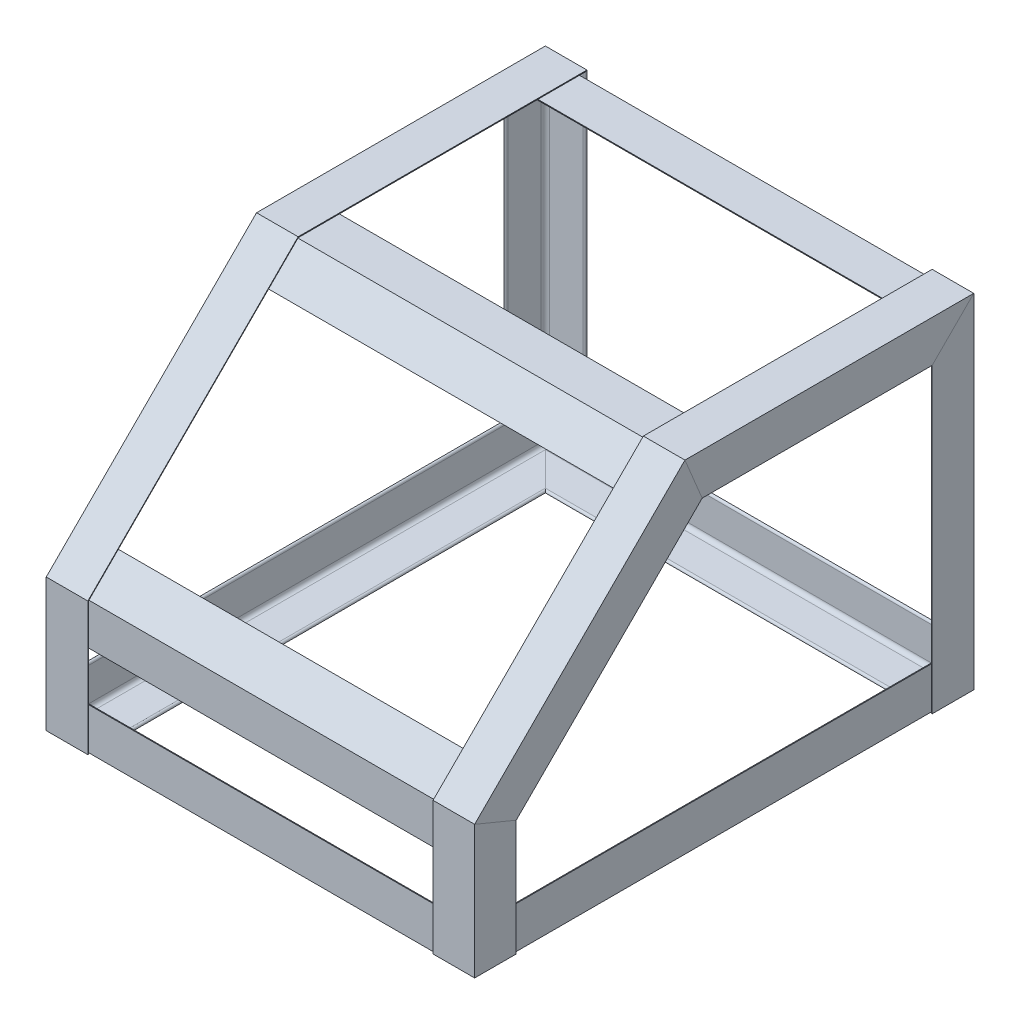
from build123d import *

# Parameters (mm, degrees)
NGULO_DE_EXTREMOS_REDONDEADOS_AL_I_AL_L_DEPTH      = 850.142792782
NGULO_DE_EXTREMOS_REDONDEADOS_AL_I_AL_L_DEPTH_BACK = 100.842792782
NGULO_DE_EXTREMOS_REDONDEADOS_AL_I_A_4_DEPTH       = 843.035585563
NGULO_DE_EXTREMOS_REDONDEADOS_AL_I_A_6_DEPTH       = 950.985585563
NGULO_DE_EXTREMOS_REDONDEADOS_AL_I_A_8_DEPTH       = 843.035585563
NGULO_DE_EXTREMOS_REDONDEADOS_AL_I_A_11_DEPTH      = 241.397438789
NGULO_DE_EXTREMOS_REDONDEADOS_AL_I_A_13_DEPTH      = 530.43662706
NGULO_DE_EXTREMOS_REDONDEADOS_AL_I_A_16_DEPTH      = 569.944
NGULO_DE_EXTREMOS_REDONDEADOS_AL_I_A_19_DEPTH      = 615.058561211
NGULO_DE_EXTREMOS_REDONDEADOS_AL_I_A_21_DEPTH      = 241.397438789
NGULO_DE_EXTREMOS_REDONDEADOS_AL_I_A_23_DEPTH      = 530.43662706
NGULO_DE_EXTREMOS_REDONDEADOS_AL_I_A_26_DEPTH      = 569.944
NGULO_DE_EXTREMOS_REDONDEADOS_AL_I_A_29_DEPTH      = 615.058561211
SALIENTE_EXTRUIR1_DEPTH                            = 647.7
SALIENTE_EXTRUIR1_2_DEPTH                          = 647.7
NGULO_DE_EXTREMOS_REDONDEADOS_AL_I_A_31_DEPTH      = 641.35


with BuildPart() as part:
    # Sketch1 → ngulo de extremos redondeados al i AL L (new, two sides: drawn at the far end of the back side and taken through both)
    with BuildSketch(Plane(origin=(-3.175, -9.525, -749.3), x_dir=(1, 0, 0), z_dir=(0, 0, 1)).offset(-NGULO_DE_EXTREMOS_REDONDEADOS_AL_I_AL_L_DEPTH_BACK)):
        with BuildLine():
            Line((0, 0), (0, 63.5))
            Line((0, 63.5), (0.00508, 63.5))
            ThreePointArc((0.00508, 63.5), (2.246551928, 62.571551928), (3.175, 60.33008))
            Line((3.175, 60.33008), (3.175, 9.525))
            ThreePointArc((3.175, 9.525), (5.034871939, 5.034871939), (9.525, 3.175))
            Line((9.525, 3.175), (60.33008, 3.175))
            ThreePointArc((60.33008, 3.175), (62.571551928, 2.246551928), (63.5, 0.00508))
            Line((63.5, 0.00508), (63.5, 0))
            Line((63.5, 0), (0, 0))
        make_face()
    extrude(amount=NGULO_DE_EXTREMOS_REDONDEADOS_AL_I_AL_L_DEPTH + NGULO_DE_EXTREMOS_REDONDEADOS_AL_I_AL_L_DEPTH_BACK)

    # ngulo de extremos redondeados al i A 2
    split(bisect_by=Plane(origin=(0, 0, -749.3), x_dir=(0, -1, 0), z_dir=(-0.707106781, 0, 0.707106781)), keep=Keep.TOP)

    # ngulo de extremos redondeados al i A 3
    split(bisect_by=Plane(origin=(0, 0, 0), x_dir=(0, -1, 0), z_dir=(-0.707106781, 0, -0.707106781)), keep=Keep.TOP)


with BuildPart() as body_2:
    # Sketch1 on segment 2 (carried to segment 2) → ngulo de extremos redondeados al i A 4 (new body)
    with BuildSketch(Plane(origin=(-100.842792782, -9.525, 3.175), x_dir=(0, 0, -1), z_dir=(1, 0, 0))):
        with BuildLine():
            Line((0, 0), (0, 63.5))
            Line((0, 63.5), (0.00508, 63.5))
            ThreePointArc((0.00508, 63.5), (2.246551928, 62.571551928), (3.175, 60.33008))
            Line((3.175, 60.33008), (3.175, 9.525))
            ThreePointArc((3.175, 9.525), (5.034871939, 5.034871939), (9.525, 3.175))
            Line((9.525, 3.175), (60.33008, 3.175))
            ThreePointArc((60.33008, 3.175), (62.571551928, 2.246551928), (63.5, 0.00508))
            Line((63.5, 0.00508), (63.5, 0))
            Line((63.5, 0), (0, 0))
        make_face()
    extrude(amount=NGULO_DE_EXTREMOS_REDONDEADOS_AL_I_A_4_DEPTH)

    # ngulo de extremos redondeados al i A 4 m
    split(bisect_by=Plane(origin=(641.35, 0, 0), x_dir=(0, -1, 0), z_dir=(-0.707106781, 0, 0.707106781)), keep=Keep.TOP)

    # ngulo de extremos redondeados al i A 5
    split(bisect_by=Plane(origin=(0, 0, 0), x_dir=(0, 1, 0), z_dir=(0.707106781, 0, 0.707106781)), keep=Keep.TOP)


with BuildPart() as body_3:
    # Sketch1 on segment 3 (carried to segment 3) → ngulo de extremos redondeados al i A 6 (new body)
    with BuildSketch(Plane(origin=(644.525, -9.525, 100.842792782), x_dir=(-1, 0, 0), z_dir=(0, 0, -1))):
        with BuildLine():
            Line((0, 0), (0, 63.5))
            Line((0, 63.5), (0.00508, 63.5))
            ThreePointArc((0.00508, 63.5), (2.246551928, 62.571551928), (3.175, 60.33008))
            Line((3.175, 60.33008), (3.175, 9.525))
            ThreePointArc((3.175, 9.525), (5.034871939, 5.034871939), (9.525, 3.175))
            Line((9.525, 3.175), (60.33008, 3.175))
            ThreePointArc((60.33008, 3.175), (62.571551928, 2.246551928), (63.5, 0.00508))
            Line((63.5, 0.00508), (63.5, 0))
            Line((63.5, 0), (0, 0))
        make_face()
    extrude(amount=NGULO_DE_EXTREMOS_REDONDEADOS_AL_I_A_6_DEPTH)

    # ngulo de extremos redondeados al i A 6 m
    split(bisect_by=Plane(origin=(641.35, 0, 0), x_dir=(0, 1, 0), z_dir=(0.707106781, 0, -0.707106781)), keep=Keep.TOP)

    # ngulo de extremos redondeados al i A 7
    split(bisect_by=Plane(origin=(641.35, 0, -749.3), x_dir=(0, 1, 0), z_dir=(0.707106781, 0, 0.707106781)), keep=Keep.TOP)


with BuildPart() as body_4:
    # Sketch1 on segment 4 (carried to segment 4) → ngulo de extremos redondeados al i A 8 (new body)
    with BuildSketch(Plane(origin=(742.192792782, -9.525, -752.475), x_dir=(0, 0, 1), z_dir=(-1, 0, 0))):
        with BuildLine():
            Line((0, 0), (0, 63.5))
            Line((0, 63.5), (0.00508, 63.5))
            ThreePointArc((0.00508, 63.5), (2.246551928, 62.571551928), (3.175, 60.33008))
            Line((3.175, 60.33008), (3.175, 9.525))
            ThreePointArc((3.175, 9.525), (5.034871939, 5.034871939), (9.525, 3.175))
            Line((9.525, 3.175), (60.33008, 3.175))
            ThreePointArc((60.33008, 3.175), (62.571551928, 2.246551928), (63.5, 0.00508))
            Line((63.5, 0.00508), (63.5, 0))
            Line((63.5, 0), (0, 0))
        make_face()
    extrude(amount=NGULO_DE_EXTREMOS_REDONDEADOS_AL_I_A_8_DEPTH)

    # ngulo de extremos redondeados al i A 8 m
    split(bisect_by=Plane(origin=(641.35, 0, -749.3), x_dir=(0, -1, 0), z_dir=(-0.707106781, 0, -0.707106781)), keep=Keep.TOP)

    # ngulo de extremos redondeados al i A 9
    split(bisect_by=Plane(origin=(0, 0, -749.3), x_dir=(0, 1, 0), z_dir=(0.707106781, 0, -0.707106781)), keep=Keep.TOP)


with BuildPart() as part_1:
    add(part.part)

    # ngulo de extremos redondeados al i A 10: union body 2, body 3, body 4
    add(body_2.part)
    add(body_3.part)
    add(body_4.part)


with BuildPart() as body_2_2:
    # Sketch12 → ngulo de extremos redondeados al i A 11 (new body)
    with BuildSketch(Plane(origin=(647.7, -9.525, 6.35), x_dir=(-1, 0, 0), z_dir=(0, -1, 0))):
        with BuildLine():
            Line((0, 0), (0, 63.5))
            Line((0, 63.5), (0.00508, 63.5))
            ThreePointArc((0.00508, 63.5), (2.246551928, 62.571551928), (3.175, 60.33008))
            Line((3.175, 60.33008), (3.175, 9.525))
            ThreePointArc((3.175, 9.525), (5.034871939, 5.034871939), (9.525, 3.175))
            Line((9.525, 3.175), (60.33008, 3.175))
            ThreePointArc((60.33008, 3.175), (62.571551928, 2.246551928), (63.5, 0.00508))
            Line((63.5, 0.00508), (63.5, 0))
            Line((63.5, 0), (0, 0))
        make_face()
    extrude(amount=-NGULO_DE_EXTREMOS_REDONDEADOS_AL_I_A_11_DEPTH)

    # ngulo de extremos redondeados al i A 12
    split(bisect_by=Plane(origin=(647.7, 193.675, 6.35), x_dir=(1, 0, 0), z_dir=(0, -0.923879533, 0.382683432)), keep=Keep.TOP)


with BuildPart() as body_3_2:
    # Sketch12 on segment 2 (carried to segment 2) → ngulo de extremos redondeados al i A 13 (new body)
    with BuildSketch(Plane(origin=(647.7, 541.740667992, -341.715667992), x_dir=(-1, 0, 0), z_dir=(0, -0.707106781, 0.707106781))):
        with BuildLine():
            Line((0, 0), (0, 63.5))
            Line((0, 63.5), (0.00508, 63.5))
            ThreePointArc((0.00508, 63.5), (2.246551928, 62.571551928), (3.175, 60.33008))
            Line((3.175, 60.33008), (3.175, 9.525))
            ThreePointArc((3.175, 9.525), (5.034871939, 5.034871939), (9.525, 3.175))
            Line((9.525, 3.175), (60.33008, 3.175))
            ThreePointArc((60.33008, 3.175), (62.571551928, 2.246551928), (63.5, 0.00508))
            Line((63.5, 0.00508), (63.5, 0))
            Line((63.5, 0), (0, 0))
        make_face()
    extrude(amount=NGULO_DE_EXTREMOS_REDONDEADOS_AL_I_A_13_DEPTH)

    # ngulo de extremos redondeados al i A 14
    split(bisect_by=Plane(origin=(647.7, 193.675, 6.35), x_dir=(-1, 0, 0), z_dir=(0, 0.923879533, -0.382683432)), keep=Keep.TOP)

    # ngulo de extremos redondeados al i A 15
    split(bisect_by=Plane(origin=(647.7, 514.731, -314.706), x_dir=(0, -0.923879533, -0.382683432), z_dir=(0, -0.382683432, 0.923879533)), keep=Keep.TOP)


with BuildPart() as body_4_2:
    # Sketch12 on segment 3 (carried to segment 3) → ngulo de extremos redondeados al i A 16 (new body)
    with BuildSketch(Plane(origin=(647.7, 514.731, -846.452561211), x_dir=(-1, 0, 0), z_dir=(0, 0, 1))):
        with BuildLine():
            Line((0, 0), (0, 63.5))
            Line((0, 63.5), (0.00508, 63.5))
            ThreePointArc((0.00508, 63.5), (2.246551928, 62.571551928), (3.175, 60.33008))
            Line((3.175, 60.33008), (3.175, 9.525))
            ThreePointArc((3.175, 9.525), (5.034871939, 5.034871939), (9.525, 3.175))
            Line((9.525, 3.175), (60.33008, 3.175))
            ThreePointArc((60.33008, 3.175), (62.571551928, 2.246551928), (63.5, 0.00508))
            Line((63.5, 0.00508), (63.5, 0))
            Line((63.5, 0), (0, 0))
        make_face()
    extrude(amount=NGULO_DE_EXTREMOS_REDONDEADOS_AL_I_A_16_DEPTH)

    # ngulo de extremos redondeados al i A 17
    split(bisect_by=Plane(origin=(647.7, 514.731, -314.706), x_dir=(0, 0.923879533, 0.382683432), z_dir=(0, 0.382683432, -0.923879533)), keep=Keep.TOP)

    # ngulo de extremos redondeados al i A 18
    split(bisect_by=Plane(origin=(647.7, 514.731, -755.65), x_dir=(-1, 0, 0), z_dir=(0, 0.707106781, 0.707106781)), keep=Keep.TOP)


with BuildPart() as body_5:
    # Sketch12 on segment 4 (carried to segment 4) → ngulo de extremos redondeados al i A 19 (new body)
    with BuildSketch(Plane(origin=(647.7, -9.525, -755.65), x_dir=(-1, 0, 0), z_dir=(0, 1, 0))):
        with BuildLine():
            Line((0, 0), (0, 63.5))
            Line((0, 63.5), (0.00508, 63.5))
            ThreePointArc((0.00508, 63.5), (2.246551928, 62.571551928), (3.175, 60.33008))
            Line((3.175, 60.33008), (3.175, 9.525))
            ThreePointArc((3.175, 9.525), (5.034871939, 5.034871939), (9.525, 3.175))
            Line((9.525, 3.175), (60.33008, 3.175))
            ThreePointArc((60.33008, 3.175), (62.571551928, 2.246551928), (63.5, 0.00508))
            Line((63.5, 0.00508), (63.5, 0))
            Line((63.5, 0), (0, 0))
        make_face()
    extrude(amount=NGULO_DE_EXTREMOS_REDONDEADOS_AL_I_A_19_DEPTH)

    # ngulo de extremos redondeados al i A 20
    split(bisect_by=Plane(origin=(647.7, 514.731, -755.65), x_dir=(1, 0, 0), z_dir=(0, -0.707106781, -0.707106781)), keep=Keep.TOP)


with BuildPart() as body_6:
    # Sketch17 → ngulo de extremos redondeados al i A 21 (new body)
    with BuildSketch(Plane(origin=(-6.35, -9.525, 6.35), x_dir=(1, 0, 0), z_dir=(0, 1, 0))):
        with BuildLine():
            Line((0, 0), (0, 63.5))
            Line((0, 63.5), (0.00508, 63.5))
            ThreePointArc((0.00508, 63.5), (2.246551928, 62.571551928), (3.175, 60.33008))
            Line((3.175, 60.33008), (3.175, 9.525))
            ThreePointArc((3.175, 9.525), (5.034871939, 5.034871939), (9.525, 3.175))
            Line((9.525, 3.175), (60.33008, 3.175))
            ThreePointArc((60.33008, 3.175), (62.571551928, 2.246551928), (63.5, 0.00508))
            Line((63.5, 0.00508), (63.5, 0))
            Line((63.5, 0), (0, 0))
        make_face()
    extrude(amount=NGULO_DE_EXTREMOS_REDONDEADOS_AL_I_A_21_DEPTH)

    # ngulo de extremos redondeados al i A 22
    split(bisect_by=Plane(origin=(-6.35, 193.675, 6.35), x_dir=(1, 0, 0), z_dir=(0, -0.923879533, 0.382683432)), keep=Keep.TOP)


with BuildPart() as body_7:
    # Sketch17 on segment 2 (carried to segment 2) → ngulo de extremos redondeados al i A 23 (new body)
    with BuildSketch(Plane(origin=(-6.35, 166.665332008, 33.359667992), x_dir=(1, 0, 0), z_dir=(0, 0.707106781, -0.707106781))):
        with BuildLine():
            Line((0, 0), (0, 63.5))
            Line((0, 63.5), (0.00508, 63.5))
            ThreePointArc((0.00508, 63.5), (2.246551928, 62.571551928), (3.175, 60.33008))
            Line((3.175, 60.33008), (3.175, 9.525))
            ThreePointArc((3.175, 9.525), (5.034871939, 5.034871939), (9.525, 3.175))
            Line((9.525, 3.175), (60.33008, 3.175))
            ThreePointArc((60.33008, 3.175), (62.571551928, 2.246551928), (63.5, 0.00508))
            Line((63.5, 0.00508), (63.5, 0))
            Line((63.5, 0), (0, 0))
        make_face()
    extrude(amount=NGULO_DE_EXTREMOS_REDONDEADOS_AL_I_A_23_DEPTH)

    # ngulo de extremos redondeados al i A 24
    split(bisect_by=Plane(origin=(-6.35, 193.675, 6.35), x_dir=(-1, 0, 0), z_dir=(0, 0.923879533, -0.382683432)), keep=Keep.TOP)

    # ngulo de extremos redondeados al i A 25
    split(bisect_by=Plane(origin=(-6.35, 514.731, -314.706), x_dir=(0, -0.923879533, -0.382683432), z_dir=(0, -0.382683432, 0.923879533)), keep=Keep.TOP)


with BuildPart() as body_8:
    # Sketch17 on segment 3 (carried to segment 3) → ngulo de extremos redondeados al i A 26 (new body)
    with BuildSketch(Plane(origin=(-6.35, 514.731, -276.508561211), x_dir=(1, 0, 0), z_dir=(0, 0, -1))):
        with BuildLine():
            Line((0, 0), (0, 63.5))
            Line((0, 63.5), (0.00508, 63.5))
            ThreePointArc((0.00508, 63.5), (2.246551928, 62.571551928), (3.175, 60.33008))
            Line((3.175, 60.33008), (3.175, 9.525))
            ThreePointArc((3.175, 9.525), (5.034871939, 5.034871939), (9.525, 3.175))
            Line((9.525, 3.175), (60.33008, 3.175))
            ThreePointArc((60.33008, 3.175), (62.571551928, 2.246551928), (63.5, 0.00508))
            Line((63.5, 0.00508), (63.5, 0))
            Line((63.5, 0), (0, 0))
        make_face()
    extrude(amount=NGULO_DE_EXTREMOS_REDONDEADOS_AL_I_A_26_DEPTH)

    # ngulo de extremos redondeados al i A 27
    split(bisect_by=Plane(origin=(-6.35, 514.731, -314.706), x_dir=(0, 0.923879533, 0.382683432), z_dir=(0, 0.382683432, -0.923879533)), keep=Keep.TOP)

    # ngulo de extremos redondeados al i A 28
    split(bisect_by=Plane(origin=(-6.35, 514.731, -755.65), x_dir=(-1, 0, 0), z_dir=(0, 0.707106781, 0.707106781)), keep=Keep.TOP)


with BuildPart() as body_9:
    # Sketch17 on segment 4 (carried to segment 4) → ngulo de extremos redondeados al i A 29 (new body)
    with BuildSketch(Plane(origin=(-6.35, 605.533561211, -755.65), x_dir=(1, 0, 0), z_dir=(0, -1, 0))):
        with BuildLine():
            Line((0, 0), (0, 63.5))
            Line((0, 63.5), (0.00508, 63.5))
            ThreePointArc((0.00508, 63.5), (2.246551928, 62.571551928), (3.175, 60.33008))
            Line((3.175, 60.33008), (3.175, 9.525))
            ThreePointArc((3.175, 9.525), (5.034871939, 5.034871939), (9.525, 3.175))
            Line((9.525, 3.175), (60.33008, 3.175))
            ThreePointArc((60.33008, 3.175), (62.571551928, 2.246551928), (63.5, 0.00508))
            Line((63.5, 0.00508), (63.5, 0))
            Line((63.5, 0), (0, 0))
        make_face()
    extrude(amount=NGULO_DE_EXTREMOS_REDONDEADOS_AL_I_A_29_DEPTH)

    # ngulo de extremos redondeados al i A 30
    split(bisect_by=Plane(origin=(-6.35, 514.731, -755.65), x_dir=(1, 0, 0), z_dir=(0, -0.707106781, -0.707106781)), keep=Keep.TOP)


with BuildPart() as body_10:
    # Croquis2 → Saliente-Extruir1 (new body)
    with BuildSketch(Plane(origin=(-3.175, 0, 0), x_dir=(0, 0, -1), z_dir=(1, 0, 0))):
        Polygon((-3.175, 192.359871939), (-3.175, 128.859871939), (1.5875, 128.859871939), (1.5875, 190.387179849), (45.093876651, 233.893556499), (41.726280605, 237.261152545), align=None)
    extrude(amount=SALIENTE_EXTRUIR1_DEPTH)


with BuildPart() as body_11:
    # Croquis2 → Saliente-Extruir1 2 (new body)
    with BuildSketch(Plane(origin=(-3.175, 0, 0), x_dir=(0, 0, -1), z_dir=(1, 0, 0))):
        Polygon((316.021128061, 511.556), (379.521128061, 511.556), (379.521128061, 506.7935), (317.993820151, 506.7935), (274.487443501, 463.287123349), (271.119847455, 466.654719395), align=None)
    extrude(amount=SALIENTE_EXTRUIR1_2_DEPTH)


with BuildPart() as body_12:
    # Sketch110 → ngulo de extremos redondeados al i A 31 (new body)
    with BuildSketch(Plane(origin=(0, 508.381, -749.3), x_dir=(0, -1, 0), z_dir=(-1, 0, 0))):
        with BuildLine():
            Line((0, 0), (0, 63.5))
            Line((0, 63.5), (0.00508, 63.5))
            ThreePointArc((0.00508, 63.5), (2.246551928, 62.571551928), (3.175, 60.33008))
            Line((3.175, 60.33008), (3.175, 9.525))
            ThreePointArc((3.175, 9.525), (5.034871939, 5.034871939), (9.525, 3.175))
            Line((9.525, 3.175), (60.33008, 3.175))
            ThreePointArc((60.33008, 3.175), (62.571551928, 2.246551928), (63.5, 0.00508))
            Line((63.5, 0.00508), (63.5, 0))
            Line((63.5, 0), (0, 0))
        make_face()
    extrude(amount=-NGULO_DE_EXTREMOS_REDONDEADOS_AL_I_A_31_DEPTH)


solid = Compound([part_1.part, body_2_2.part, body_3_2.part, body_4_2.part, body_5.part, body_6.part, body_7.part, body_8.part, body_9.part, body_10.part, body_11.part, body_12.part])
